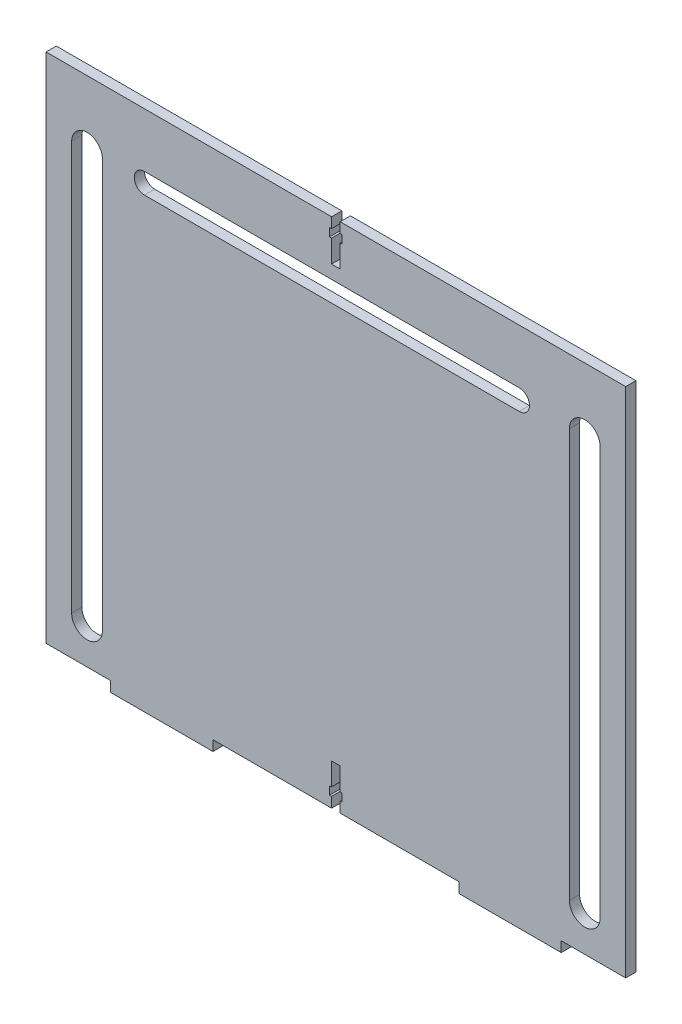
from build123d import *

# Parameters (mm, degrees)
BOSS_EXTRU_1_DEPTH      = 5
ENL_V_MAT_EXTRU_1_DEPTH = 328.095566225


with BuildPart() as part:
    # Esquisse1 → Boss.-Extru.1 (new body)
    with BuildSketch(Plane.XY):
        Polygon((-51.387751479, -19.023668639), (-19.917751479, -19.023668639), (-19.917751479, -24.023668639), (30.082248521, -24.023668639), (30.082248521, -19.023668639), (87.982248521, -19.023668639), (87.982248521, -14.023668639), (86.982248521, -14.023668639), (86.982248521, -10.023668639), (87.982248521, -10.023668639), (87.982248521, 0.976331361), (92.182248521, 0.976331361), (92.182248521, -10.023668639), (93.182248521, -10.023668639), (93.182248521, -14.023668639), (92.182248521, -14.023668639), (92.182248521, -19.023668639), (150.082248521, -19.023668639), (150.082248521, -24.023668639), (200.082248521, -24.023668639), (200.082248521, -19.023668639), (231.552248521, -19.023668639), (231.552248521, 230.976331361), (200.082248521, 230.976331361), (150.082248521, 230.976331361), (92.182248521, 230.976331361), (92.182248521, 225.976331361), (93.182248521, 225.976331361), (93.182248521, 221.976331361), (92.182248521, 221.976331361), (92.182248521, 210.976331361), (87.982248521, 210.976331361), (87.982248521, 221.976331361), (86.982248521, 221.976331361), (86.982248521, 225.976331361), (87.982248521, 225.976331361), (87.982248521, 230.976331361), (30.082248521, 230.976331361), (-19.917751479, 230.976331361), (-51.387751479, 230.976331361), align=None)
    extrude(amount=BOSS_EXTRU_1_DEPTH)

    # Esquisse2 → Enlèv. mat.-Extru.1 (cut, through all)
    with BuildSketch(Plane(origin=(0, 0, 0), x_dir=(-1, 0, 0), z_dir=(0, 0, -1))):
        with BuildLine():
            Line((-204.052248521, 199.47878379), (-204.052248521, 0))
            ThreePointArc((-204.052248521, 0), (-211.552248521, -7.5), (-219.052248521, 0))
            Line((-219.052248521, 0), (-219.052248521, 199.47878379))
            ThreePointArc((-219.052248521, 199.47878379), (-211.552248521, 206.97878379), (-204.052248521, 199.47878379))
        make_face()
        with BuildLine():
            Line((-179.579242919, 204.47878379), (3.336091455, 204.47878379))
            ThreePointArc((3.336091455, 204.47878379), (8.336091455, 199.47878379), (3.336091455, 194.47878379))
            Line((3.336091455, 194.47878379), (-179.579242919, 194.47878379))
            ThreePointArc((-179.579242919, 194.47878379), (-184.579242919, 199.47878379), (-179.579242919, 204.47878379))
        make_face()
        with BuildLine():
            Line((38.887751479, 199.47878379), (38.887751479, 0))
            ThreePointArc((38.887751479, 0), (31.387751479, -7.5), (23.887751479, 0))
            Line((23.887751479, 0), (23.887751479, 199.47878379))
            ThreePointArc((23.887751479, 199.47878379), (31.387751479, 206.97878379), (38.887751479, 199.47878379))
        make_face()
    extrude(amount=-ENL_V_MAT_EXTRU_1_DEPTH, mode=Mode.SUBTRACT)


solid = part.part
